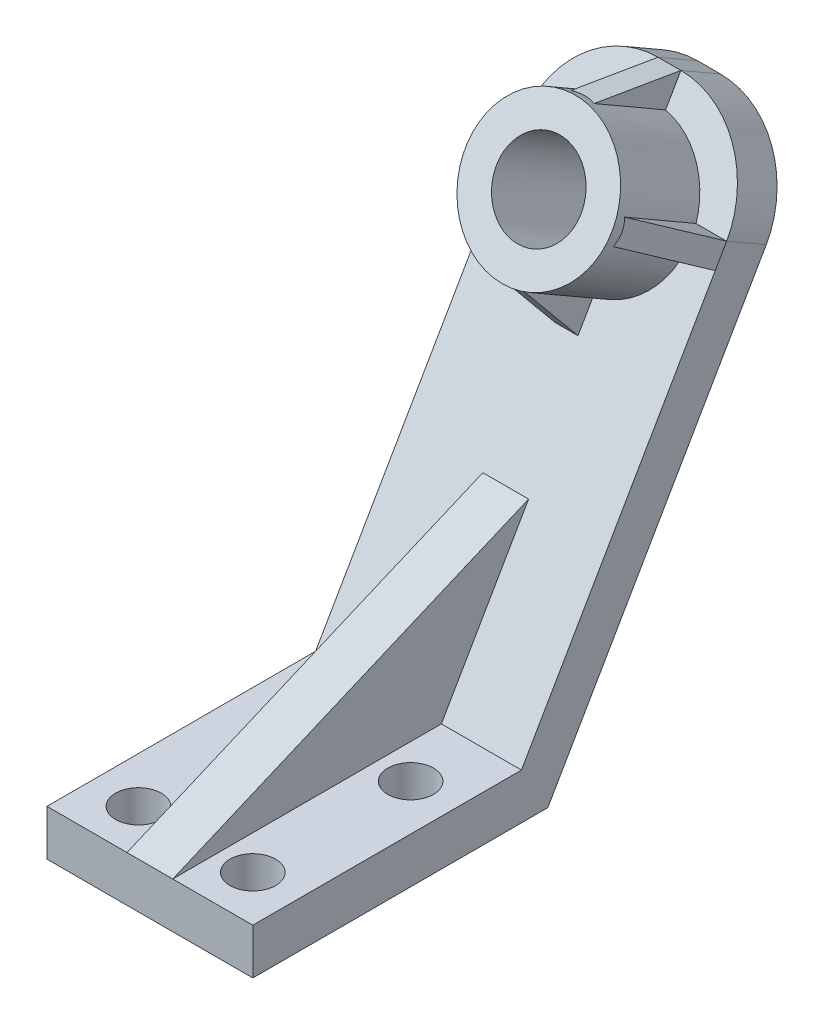
from build123d import *

# Parameters (mm, degrees)
BOSS_EXTRUDE1_DEPTH = 45
RIB1_REACH          = 327.464
SKETCH2_WALL_W      = 821.946192972
SKETCH2_WALL_H      = 20
SKETCH3_R           = 10
CUT_EXTRUDE1_DEPTH  = 313.929644864
FILLET1_R           = 40
SKETCH5_R           = 32
BOSS_EXTRUDE2_DEPTH = 40
SKETCH6_R           = 18.5
CUT_EXTRUDE2_DEPTH  = 320.005298403
RIB2_REACH          = 333.173
SKETCH7_WALL_W      = 701.683234458
SKETCH7_WALL_H      = 10
CIRPATTERN1_COUNT   = 4


with BuildPart() as part:
    # Sketch1 → Boss-Extrude1 (new, symmetric)
    with BuildSketch(Plane(origin=(0, 0, 0), x_dir=(0, 0, -1), z_dir=(1, 0, 0))):
        Polygon((0, 0), (129, 0), (244.5, 200.051868274), (227.179491924, 210.051868274), (117.452994616, 20), (0, 20), align=None)
    extrude(amount=BOSS_EXTRUDE1_DEPTH, both=True)

    # Sketch2 wall → Rib1 (add, up to next)
    with BuildSketch(Plane(origin=(0, 53.020201337, -77.790719439), x_dir=(0, 0.39073112849, -0.920504853452), z_dir=(0, 0.920504853452, 0.39073112849)), mode=Mode.PRIVATE) as rib1_sk1:
        Rectangle(SKETCH2_WALL_W, SKETCH2_WALL_H)
    rib1_tool1 = extrude(rib1_sk1.sketch, amount=-RIB1_REACH, mode=Mode.PRIVATE) - part.part
    add(rib1_tool1.solids().sort_by_distance((0, 53.020201337, -77.790719439))[0])

    # Sketch3 → Cut-Extrude1 (cut, through all)
    with BuildSketch(Plane(origin=(0, 20, 0), x_dir=(1, 0, 0), z_dir=(0, 1, 0))):
        with Locations(Location((-25, 20, 0), (0, 0, 270))):
            Circle(SKETCH3_R)
        with Locations(Location((-25, 89, 0), (0, 0, 270))):
            Circle(SKETCH3_R)
        with Locations(Location((25, 20, 0), (0, 0, 90))):
            Circle(SKETCH3_R)
        with Locations(Location((25, 89, 0), (0, 0, 90))):
            Circle(SKETCH3_R)
    extrude(amount=-CUT_EXTRUDE1_DEPTH, mode=Mode.SUBTRACT)

    # Fillet1
    fillet1_edges = [part.edges().sort_by_distance(p)[0] for p in [
        (45, 205.051868274, -235.839745962),
        (-45, 205.051868274, -235.839745962),
    ]]
    fillet(fillet1_edges, radius=FILLET1_R)

    # Sketch5 → Boss-Extrude2 (add)
    with BuildSketch(Plane(origin=(0, -45.858638544, -79.429491924), x_dir=(1, 0, 0), z_dir=(0, 0.49999999999999756, 0.86602540378444))):
        with Locations(Location((0, 250.5, 0), (0, 0, 90))):
            Circle(SKETCH5_R)
    extrude(amount=BOSS_EXTRUDE2_DEPTH)

    # Sketch6 → Cut-Extrude2 (cut, through all)
    with BuildSketch(Plane(origin=(0, -25.858638544, -44.788475773), x_dir=(1, 0, 0), z_dir=(0, 0.49999999999999756, 0.86602540378444))):
        with Locations(Location((0, 250.5, 0), (0, 0, 270))):
            Circle(SKETCH6_R)
    extrude(amount=-CUT_EXTRUDE2_DEPTH, mode=Mode.SUBTRACT)

    # Sketch7 wall → Rib2 (add, up to next)
    with BuildSketch(Plane(origin=(0, 213.172703149, -208.774047358), x_dir=(0, -0.16717425612, -0.985927364511), z_dir=(0, 0.985927364511, -0.16717425612)), mode=Mode.PRIVATE) as rib2_sk1:
        Rectangle(SKETCH7_WALL_W, SKETCH7_WALL_H)
    rib2_tool1 = extrude(rib2_sk1.sketch, amount=-RIB2_REACH, mode=Mode.PRIVATE) - part.part
    rib2 = rib2_tool1.solids().sort_by_distance((0, 213.172703149, -208.774047358))[0]
    add(rib2)

    # CirPattern1: Rib2 ×4 about axis
    cirpattern1_axis = Axis((0, 216.939363648, -125.25), (0, 0.49999999999999745, 0.8660254037844402))
    for i in range(1, CIRPATTERN1_COUNT):
        add(rib2.rotate(cirpattern1_axis, i * 360 / CIRPATTERN1_COUNT))


solid = part.part
